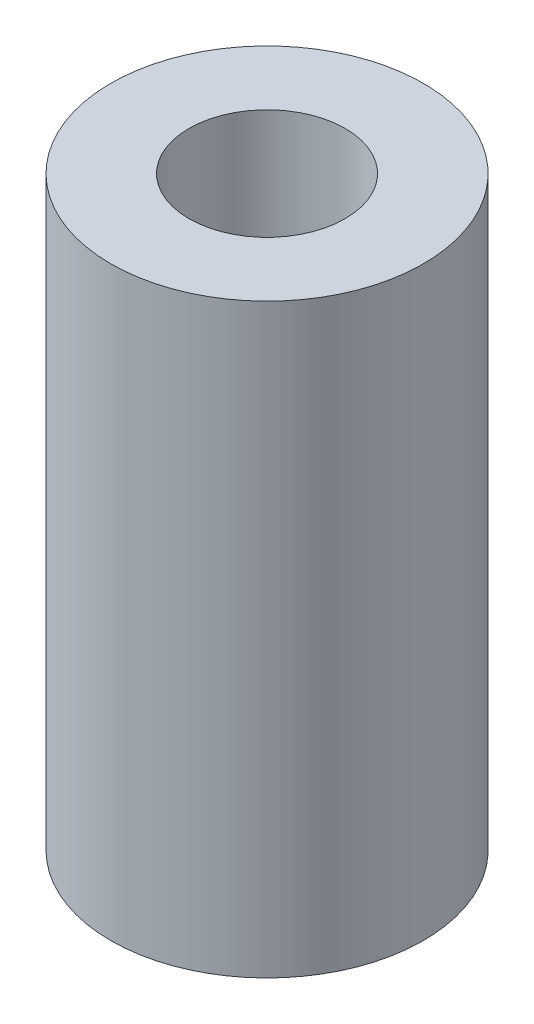
from build123d import *

# Parameters (mm, degrees)
SKETCH1_R               = 6.35
BOSS_EXTRUDE1_DEPTH     = 23.8125
CUT_EXTRUDE1_DEPTH      = 26.449561023
CUT_EXTRUDE1_DEPTH_BACK = 26.449561023
SKETCH2_R               = 3.175


with BuildPart() as part:
    # Sketch1 → Boss-Extrude1 (new body)
    with BuildSketch(Plane(origin=(0, 0, 0), x_dir=(1, 0, 0), z_dir=(0, 1, 0))):
        with Locations(Location((0, 0, 0), (0, 0, 270))):
            Circle(SKETCH1_R)
    extrude(amount=BOSS_EXTRUDE1_DEPTH)

    # Sketch2 → Cut-Extrude1 (cut, two sides: drawn at the far end of the back side and taken through both)
    with BuildSketch(Plane(origin=(0, 23.8125, 0), x_dir=(1, 0, 0), z_dir=(0, 1, 0)).offset(-CUT_EXTRUDE1_DEPTH_BACK)):
        with Locations(Location((0, 0, 0), (0, 0, 270))):
            Circle(SKETCH2_R)
    extrude(amount=CUT_EXTRUDE1_DEPTH + CUT_EXTRUDE1_DEPTH_BACK, mode=Mode.SUBTRACT)


solid = part.part
